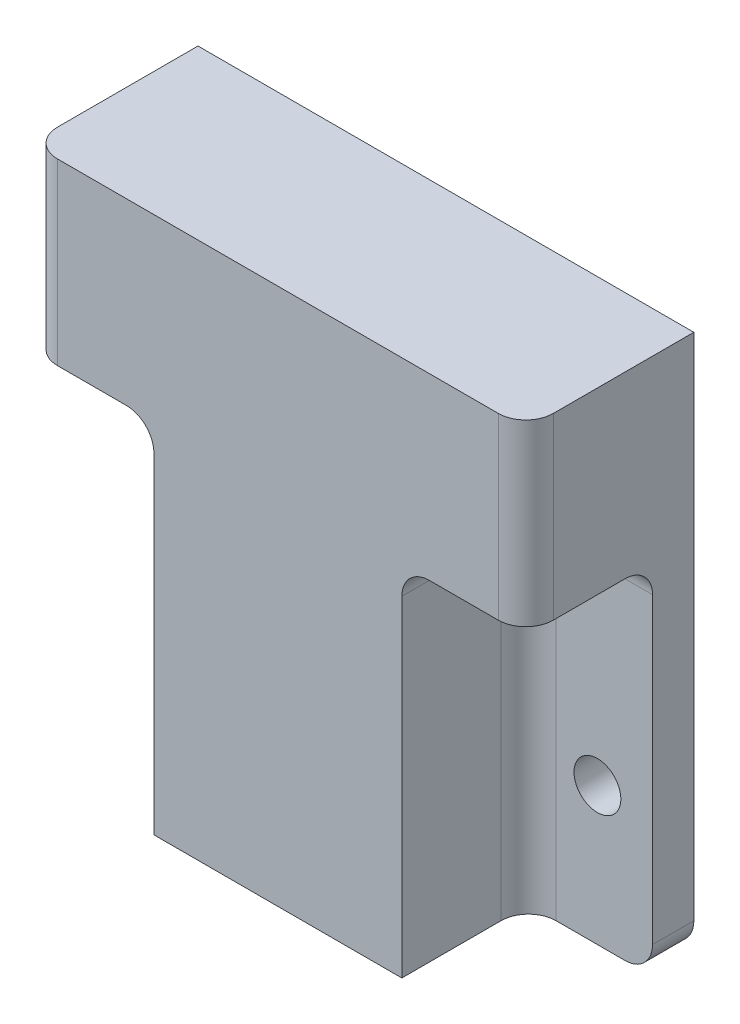
from build123d import *

# Parameters (mm, degrees)
SKIZZE1_W                       = 18
SKIZZE1_H                       = 10
AUFSATZ_LINEAR_AUSTRAGEN1_DEPTH = 3
DURCHGANGSLOCH_F_R_M31_D        = 3.4
SKIZZE5_W                       = 8
SKIZZE5_H                       = 3
AUFSATZ_LINEAR_AUSTRAGEN2_DEPTH = 3
AUFSATZ_LINEAR_AUSTRAGEN3_DEPTH = 10
AUFSATZ_LINEAR_AUSTRAGEN7_DEPTH = 9
AUFSATZ_LINEAR_AUSTRAGEN8_REACH = 29.742
SKIZZE19_W                      = 18
SKIZZE19_H                      = 3
VERRUNDUNG1_R                   = 2
VERRUNDUNG3_R                   = 2
AUFSATZ_LINEAR_START            = 10
AUFSATZ_LINEAR_AUSTRAGEN9_DEPTH = 10


with BuildPart() as part:
    # Skizze1 → Aufsatz-Linear austragen1 (new body)
    with BuildSketch(Plane.XY):
        with Locations((-9, 5)):
            Rectangle(SKIZZE1_W, SKIZZE1_H)
    extrude(amount=AUFSATZ_LINEAR_AUSTRAGEN1_DEPTH)

    # Durchgangsloch für M31 (through all)
    with Locations(Plane.XY.offset(3)):
        with Locations((-14, 0)):
            Hole(DURCHGANGSLOCH_F_R_M31_D / 2)

    # Skizze5 → Aufsatz-Linear austragen2 (add)
    with BuildSketch(Plane(origin=(0, 0, 0), x_dir=(-1, 0, 0), z_dir=(0, 0, -1))):
        with Locations((4, 1.5)):
            Rectangle(SKIZZE5_W, SKIZZE5_H)
    extrude(amount=AUFSATZ_LINEAR_AUSTRAGEN2_DEPTH)

    # Skizze7 → Aufsatz-Linear austragen3 (add)
    with BuildSketch(Plane(origin=(0, 10, 0), x_dir=(1, 0, 0), z_dir=(0, 1, 0))):
        Polygon((-6.5, -3), (-6.5, -9), (0, -9), (0, -12.2), (-9, -12.2), (-9, -3), align=None)
    extrude(amount=-AUFSATZ_LINEAR_AUSTRAGEN3_DEPTH)

    # Spiegeln2: part across plane


with BuildPart() as part_1:
    add(part.part)
    add(part.part.mirror(Plane(origin=(0, 0, 3), x_dir=(0, 0, 1), z_dir=(0, 1, 0))))

    # Skizze16 → Aufsatz-Linear austragen7 (add)
    with BuildSketch(Plane(origin=(0, 10, 0), x_dir=(1, 0, 0), z_dir=(0, 1, 0))):
        Polygon((0, 0), (-18, 0), (-18, -3), (-9, -3), (-9, -12.2), (0, -12.2), (0, -9), (-6.5, -9), (-6.5, -3), (0, -3), align=None)
    extrude(amount=AUFSATZ_LINEAR_AUSTRAGEN7_DEPTH)

    # Aufsatz-Linear austragen8: up to this face of the body (flat: up to its plane)
    aufsatz_linear_austragen8_end = Plane(part_1.part.faces().sort_by_distance((-4.5, 5, 12.2))[0])
    # Skizze19 → Aufsatz-Linear austragen8 (add, up to the picked face)
    with BuildSketch(Plane.XY.offset(3), mode=Mode.PRIVATE) as aufsatz_linear_austragen8_sk1:
        with Locations((-9, 17.5)):
            Rectangle(SKIZZE19_W, SKIZZE19_H)
    aufsatz_linear_austragen8_tool1 = split(extrude(aufsatz_linear_austragen8_sk1.sketch, amount=AUFSATZ_LINEAR_AUSTRAGEN8_REACH, mode=Mode.PRIVATE), bisect_by=aufsatz_linear_austragen8_end, keep=Keep.BOTH, mode=Mode.PRIVATE)
    add(aufsatz_linear_austragen8_tool1.solids().sort_by(Axis((-9, 17.5, 3), (0, 0, 1)))[0])

    # Verrundung1
    verrundung1_edges = [part_1.edges().sort_by_distance(p)[0] for p in [
        (-9, 16, 7.6),
        (-13.5, 16, 3),
        (-18, 17.5, 12.2),
        (-9, 5, 3),
    ]]
    fillet(verrundung1_edges, radius=VERRUNDUNG1_R)

    # Verrundung3
    verrundung3_edges = [part_1.edges().sort_by_distance(p)[0] for p in [
        (-18, -10, 1.5),
    ]]
    fillet(verrundung3_edges, radius=VERRUNDUNG3_R)

    # Spiegeln1: part across plane


with BuildPart() as part_2:
    add(part_1.part)
    add(part_1.part.mirror(Plane(origin=(0, 0, 3), x_dir=(0, 0, 1), z_dir=(-1, 0, 0))))

    # Skizze20 → Aufsatz-Linear austragen9 (add)
    with BuildSketch(Plane(origin=(0, 19, 0), x_dir=(1, 0, 0), z_dir=(0, 1, 0)).offset(AUFSATZ_LINEAR_START)):
        with BuildLine():
            Line((-18, 0), (-18, -10.2))
            ThreePointArc((-18, -10.2), (-17.414213562, -11.614213562), (-16, -12.2))
            Line((-16, -12.2), (16, -12.2))
            ThreePointArc((16, -12.2), (17.414213562, -11.614213562), (18, -10.2))
            Line((18, -10.2), (18, 0))
            Line((18, 0), (-18, 0))
        make_face()
    extrude(amount=-AUFSATZ_LINEAR_AUSTRAGEN9_DEPTH)


solid = part_2.part
